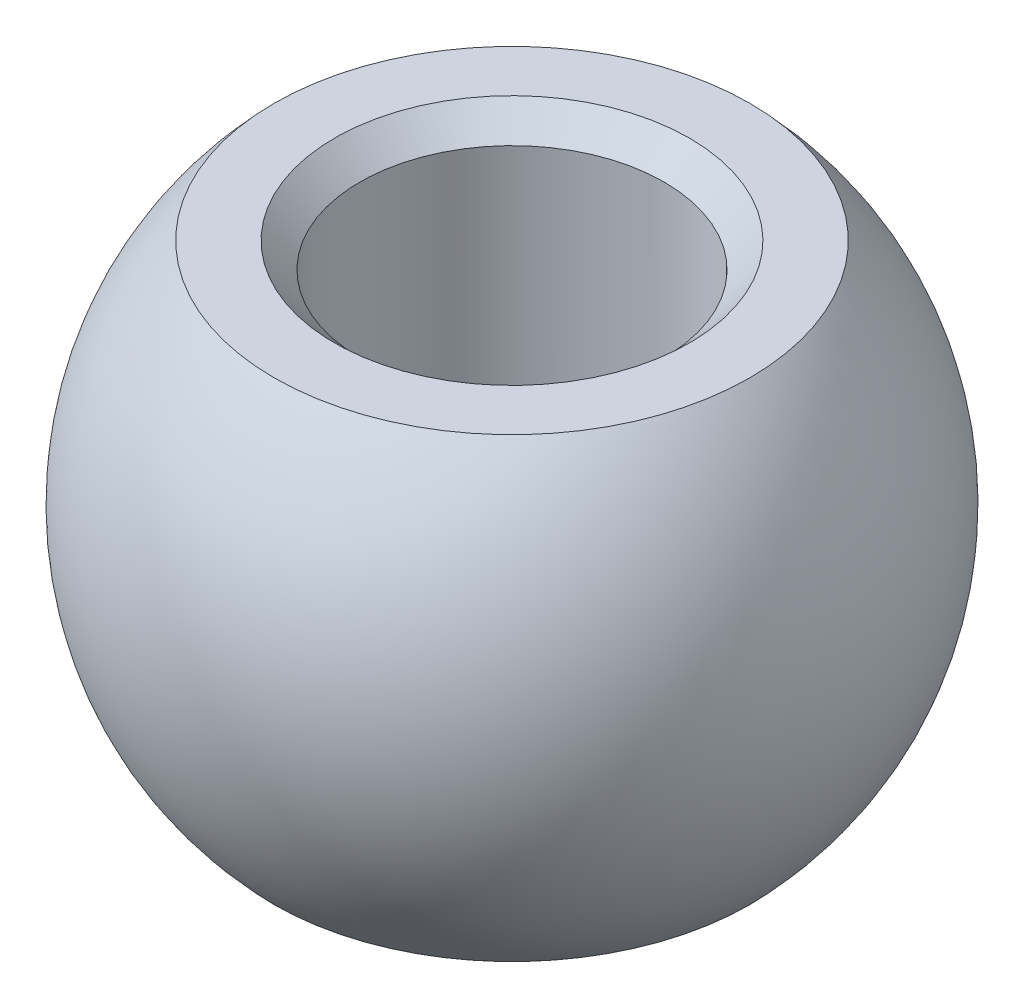
from build123d import *

# Parameters (mm, degrees)
TAGLIO_ESTRUSIONE1_DEPTH      = 12.258330249
TAGLIO_ESTRUSIONE1_DEPTH_BACK = 12.258330249
SCHIZZO2_W                    = 14.577161361
SCHIZZO2_H                    = 2.36968633
SCHIZZO2_H_2                  = 2.58511236
SCHIZZO3_R                    = 3
TAGLIO_ESTRUSIONE2_DEPTH      = 13.86468033
SMUSSO1_SIZE                  = 0.5


with BuildPart() as part:
    # Schizzo1 → Rivoluzione1 (revolve)
    with BuildSketch(Plane.XY):
        with BuildLine():
            Line((0, 6.5), (0, -6.5))
            ThreePointArc((0, -6.5), (-6.5, 0), (0, 6.5))
        make_face()
    revolve(axis=Axis((0, 8.58113686, 0), (0, -1, 0)))

    # Schizzo2 → Taglio-Estrusione1 (cut, two sides: drawn at the far end of the back side and taken through both)
    with BuildSketch(Plane.XY.offset(-TAGLIO_ESTRUSIONE1_DEPTH_BACK)):
        with Locations((0.181731429, 5.684843165)):
            Rectangle(SCHIZZO2_W, SCHIZZO2_H)
        with Locations((0.181731429, -5.79255618)):
            Rectangle(SCHIZZO2_W, SCHIZZO2_H_2)
    extrude(amount=TAGLIO_ESTRUSIONE1_DEPTH + TAGLIO_ESTRUSIONE1_DEPTH_BACK, mode=Mode.SUBTRACT)

    # Schizzo3 → Taglio-Estrusione2 (cut, through all)
    with BuildSketch(Plane(origin=(0, 4.5, 0), x_dir=(-1, 0, 0), z_dir=(0, 1, 0))):
        Circle(SCHIZZO3_R)
    extrude(amount=-TAGLIO_ESTRUSIONE2_DEPTH, mode=Mode.SUBTRACT)

    # Smusso1
    smusso1_edges = [part.edges().sort_by_distance(p)[0] for p in [
        (3, -4.5, 0),
        (3, 4.5, 0),
    ]]
    chamfer(smusso1_edges, length=SMUSSO1_SIZE)


solid = part.part
